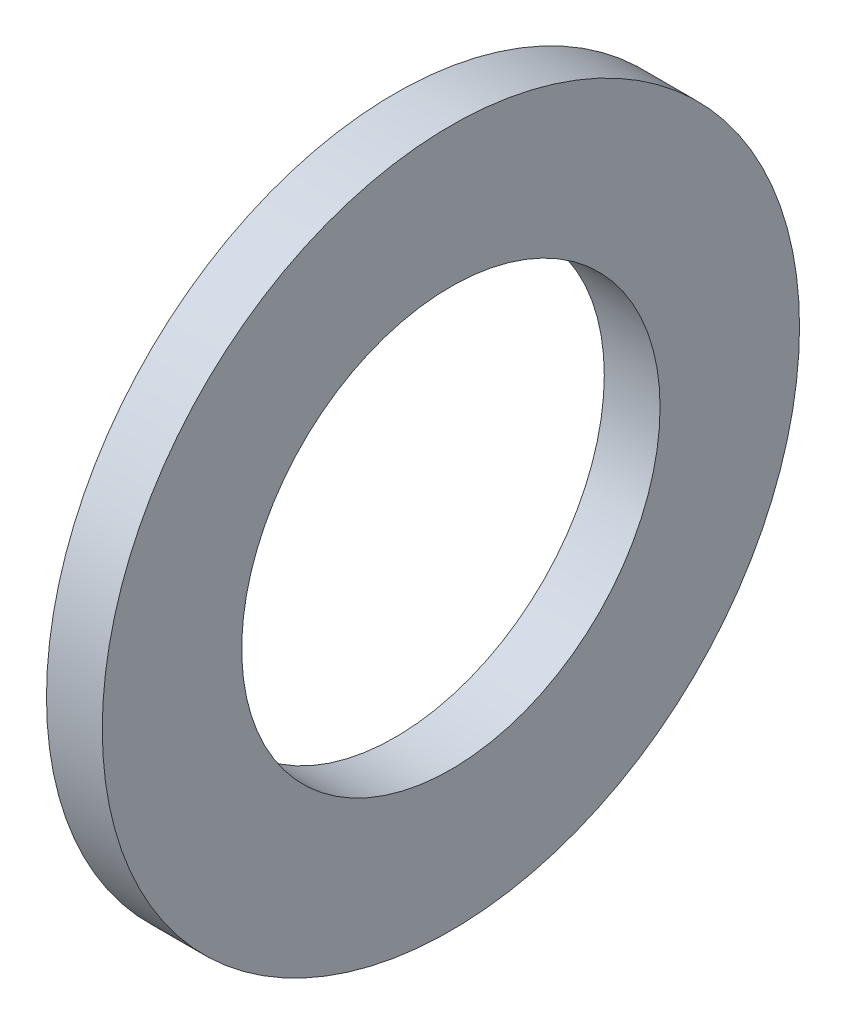
from build123d import *

# Parameters (mm, degrees)
SKETCH1_R           = 12.5
SKETCH1_R_2         = 7.5
BOSS_EXTRUDE1_DEPTH = 1


with BuildPart() as part:
    # Sketch1 → Boss-Extrude1 (new, symmetric)
    with BuildSketch(Plane(origin=(0, 0, 0), x_dir=(0, 0, -1), z_dir=(1, 0, 0))):
        Circle(SKETCH1_R)
        Circle(SKETCH1_R_2, mode=Mode.SUBTRACT)
    extrude(amount=BOSS_EXTRUDE1_DEPTH, both=True)


solid = part.part
